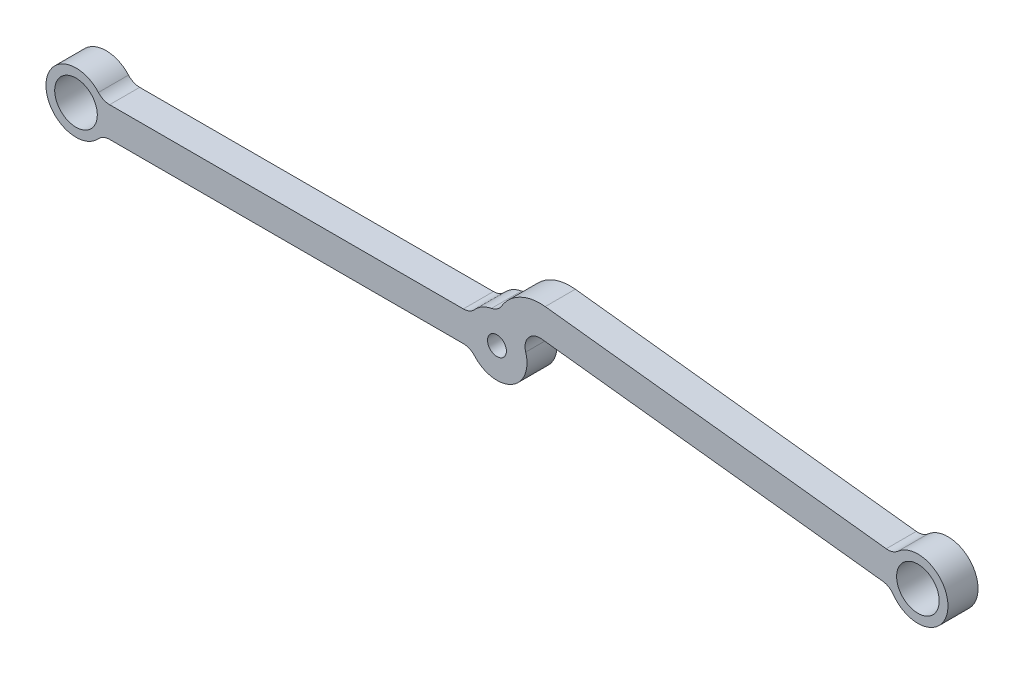
from build123d import *

# Parameters (mm, degrees)
SKETCH1_R           = 4.49961
SKETCH1_R_2         = 1.9939
BOSS_EXTRUDE1_DEPTH = 6.35
FILLET2_R           = 3.175


with BuildPart() as part:
    # Sketch1 → Boss-Extrude1 (new body)
    with BuildSketch(Plane.XY):
        with BuildLine():
            Line((-83.400738686, -3.175), (-5.499261314, -3.175))
            ThreePointArc((-5.499261314, -3.175), (2.532857004, -5.822983376), (6.072024587, 1.858229644))
            ThreePointArc((6.072024587, 1.858229644), (6.667791277, 4.818557399), (9.470894014, 5.941541551))
            Line((9.470894014, 5.941541551), (83.073913127, -2.525710148))
            ThreePointArc((83.073913127, -2.525710148), (95.20839431, -0.725714286), (83.799627413, 3.782684163))
            Line((83.799627413, 3.782684163), (10.196608307, 12.249935861))
            ThreePointArc((10.196608307, 12.249935861), (4.237192952, 10.972727963), (0.272052538, 6.344169561))
            ThreePointArc((0.272052538, 6.344169561), (-3.056441857, 5.566027594), (-5.499261314, 3.175))
            Line((-5.499261314, 3.175), (-83.400738686, 3.175))
            ThreePointArc((-83.400738686, 3.175), (-95.25, 0), (-83.400738686, -3.175))
        make_face()
        with Locations((-88.9, 0)):
            Circle(SKETCH1_R, mode=Mode.SUBTRACT)
        Circle(SKETCH1_R_2, mode=Mode.SUBTRACT)
        with Locations((88.9, 0)):
            Circle(SKETCH1_R, mode=Mode.SUBTRACT)
    extrude(amount=BOSS_EXTRUDE1_DEPTH)

    # Fillet2
    fillet2_edges = [part.edges().sort_by_distance(p)[0] for p in [
        (-5.499261314, -3.175, 3.175),
        (-83.400738686, -3.175, 3.175),
        (-83.400738686, 3.175, 3.175),
        (-5.499261314, 3.175, 3.175),
        (0.272052538, 6.344169561, 3.175),
        (83.799627413, 3.782684163, 3.175),
        (83.073913127, -2.525710148, 3.175),
    ]]
    fillet(fillet2_edges, radius=FILLET2_R)


solid = part.part
